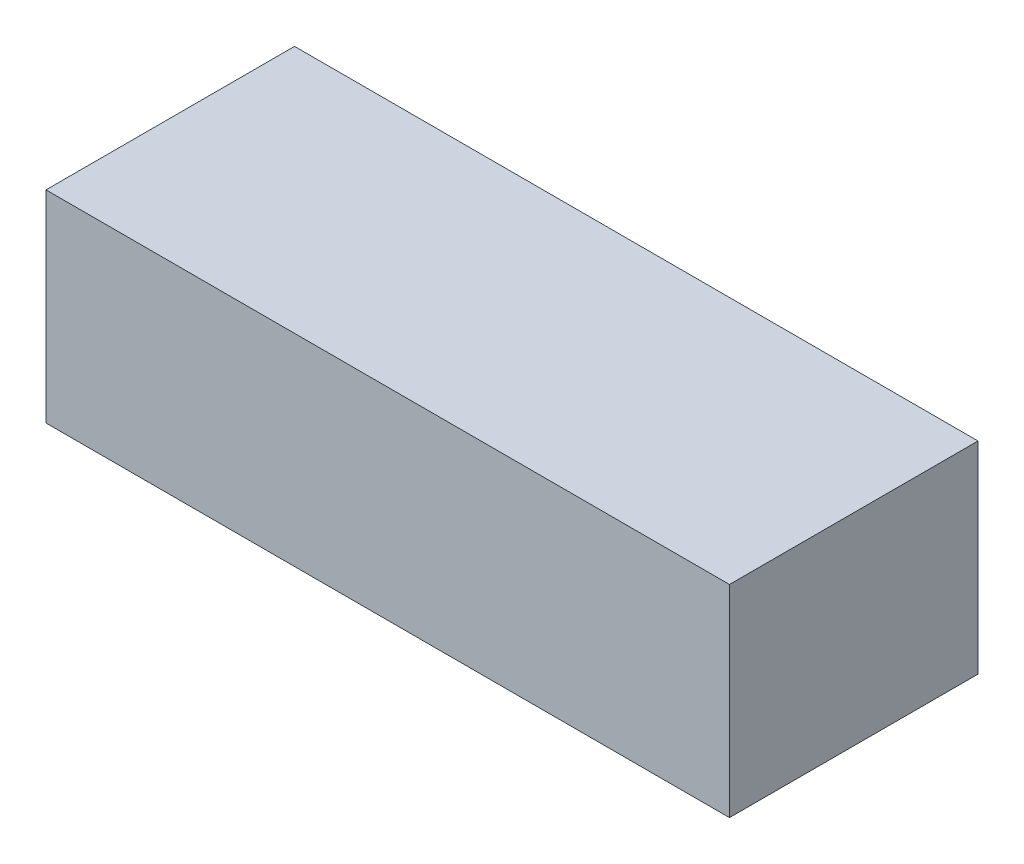
from build123d import *

# Parameters (mm, degrees)
SKETCH_1_W                             = 44
SKETCH_1_H                             = 16
EXTRUDE_1_DEPTH                        = 2
SKETCH_2_W                             = 44
SKETCH_2_H                             = 16
SKETCH_2_W_2                           = 40
SKETCH_2_H_2                           = 12
EXTRUDE_2_DEPTH                        = 10
SKETCH_3_W                             = 5.5
SKETCH_3_H                             = 4
CUT_EXTRUDE_1_DEPTH                    = 2
SKETCH_4_W                             = 1.7
SKETCH_4_H                             = 12
EXTRUDE_4_DEPTH                        = 4.6
SKETCH_9_W                             = 44
SKETCH_9_H                             = 16
SKETCH_9_W_2                           = 42
SKETCH_9_H_2                           = 14
EXTRUDE_5_DEPTH                        = 1
SKETCH_12_W                            = 1
SKETCH_12_H                            = 12
CUT_EXTRUDE_3_DEPTH                    = 5
SKETCH_13_W                            = 41.2
SKETCH_13_H                            = 13.2
SKETCH_13_W_2                          = 40
SKETCH_13_H_2                          = 12
REVB_ASSEMBLYCLEARANCE_41P2X13P2_DEPTH = 11
SKETCH_14_W                            = 11
SKETCH_14_H                            = 7
REVB_USB_TOPLOADING_USLOT_DEPTH        = 2.1
SKETCH_17_W                            = 10.6
SKETCH_17_H                            = 1.01
REVB_UNDERSIDESOLDERRELIEF_1MM_DEPTH   = 28


with BuildPart() as part:
    # 草图1 → 凸台-拉伸1 (new body)
    with BuildSketch(Plane(origin=(0, 0, 0), x_dir=(1, 0, 0), z_dir=(0, 1, 0))):
        Rectangle(SKETCH_1_W, SKETCH_1_H)
    extrude(amount=-EXTRUDE_1_DEPTH)

    # 草图2 → 凸台-拉伸2 (add)
    with BuildSketch(Plane.XZ.offset(2)):
        Rectangle(SKETCH_2_W, SKETCH_2_H)
        Rectangle(SKETCH_2_W_2, SKETCH_2_H_2, mode=Mode.SUBTRACT)
    extrude(amount=EXTRUDE_2_DEPTH)

    # 草图3 → 切除-拉伸1 (cut)
    with BuildSketch(Plane.ZY.offset(22)):
        with Locations((2.75, -9)):
            Rectangle(SKETCH_3_W, SKETCH_3_H)
        with Locations((-2.75, -9)):
            Rectangle(SKETCH_3_W, SKETCH_3_H)
    extrude(amount=-CUT_EXTRUDE_1_DEPTH, mode=Mode.SUBTRACT)

    # 草图4 → 凸台-拉伸4 (add)
    with BuildSketch(Plane.XZ.offset(2)):
        with Locations((7.15, 0)):
            Rectangle(SKETCH_4_W, SKETCH_4_H)
        with Locations((-19.15, 0)):
            Rectangle(SKETCH_4_W, SKETCH_4_H)
        with Locations((-6, 0)):
            Rectangle(SKETCH_4_W, SKETCH_4_H)
    extrude(amount=EXTRUDE_4_DEPTH)

    # 草图9 → 凸台-拉伸5 (add)
    with BuildSketch(Plane.XZ.offset(12)):
        Rectangle(SKETCH_9_W, SKETCH_9_H)
        Rectangle(SKETCH_9_W_2, SKETCH_9_H_2, mode=Mode.SUBTRACT)
    extrude(amount=EXTRUDE_5_DEPTH)

    # 草图12 → 切除-拉伸3 (cut)
    with BuildSketch(Plane.XZ.offset(12)):
        with Locations((20.5, 0)):
            Rectangle(SKETCH_12_W, SKETCH_12_H)
    extrude(amount=-CUT_EXTRUDE_3_DEPTH, mode=Mode.SUBTRACT)

    # 草图13 → RevB_AssemblyClearance_41p2x13p2 (cut)
    with BuildSketch(Plane.XZ.offset(13)):
        Rectangle(SKETCH_13_W, SKETCH_13_H)
        Rectangle(SKETCH_13_W_2, SKETCH_13_H_2, mode=Mode.SUBTRACT)
    extrude(amount=-REVB_ASSEMBLYCLEARANCE_41P2X13P2_DEPTH, mode=Mode.SUBTRACT)

    # 草图14 → RevB_USB_TopLoading_Uslot (cut)
    with BuildSketch(Plane.ZY.offset(22)):
        with Locations((0, -10.5)):
            Rectangle(SKETCH_14_W, SKETCH_14_H)
    extrude(amount=-REVB_USB_TOPLOADING_USLOT_DEPTH, mode=Mode.SUBTRACT)

    # 草图17 → RevB_UndersideSolderRelief_1mm (cut)
    with BuildSketch(Plane(origin=(8, 0, 0), x_dir=(0, 0, -1), z_dir=(1, 0, 0))):
        with Locations((0, -6.105)):
            Rectangle(SKETCH_17_W, SKETCH_17_H)
    extrude(amount=-REVB_UNDERSIDESOLDERRELIEF_1MM_DEPTH, mode=Mode.SUBTRACT)


solid = part.part
